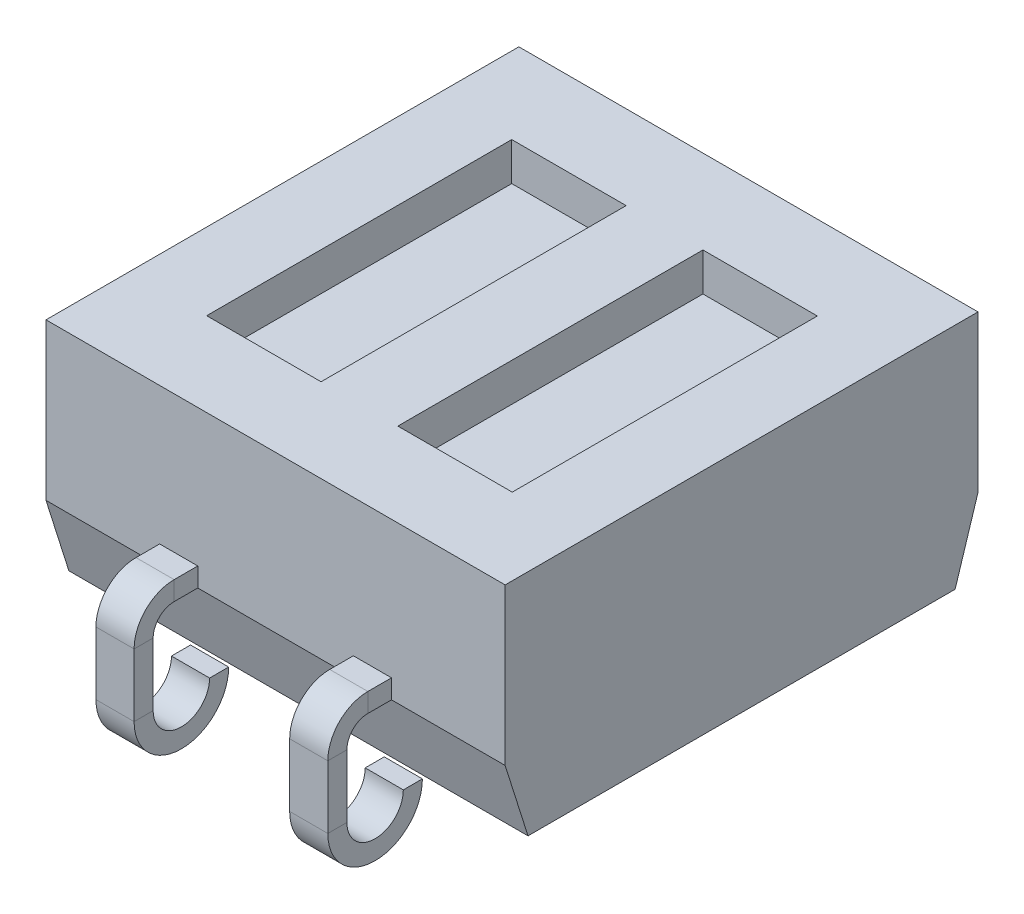
from build123d import *

# Parameters (mm, degrees)
SKETCH_3_W               = 6.02
SKETCH_3_H               = 6.2
EXTRUDE_1_DEPTH          = 3
SKETCH_4_W               = 1.5
SKETCH_4_H               = 4
CUT_EXTRUDE_1_DEPTH      = 0.5
CUT_EXTRUDE_2_DEPTH      = 8.406105589
SKETCH_6_W               = 0.5
SKETCH_6_H               = 0.25
PATTERN_LINEAR_1_COUNT   = 2
PATTERN_LINEAR_1_PITCH   = 2.54
MIRROR_1_COPY_1_SKETCH_W = 0.5
MIRROR_1_COPY_1_SKETCH_H = 0.25


with BuildPart() as part:
    # Эскиз3 → Бобышка-Вытянуть1 (new body)
    with BuildSketch(Plane(origin=(0, 0, 0), x_dir=(1, 0, 0), z_dir=(0, 1, 0))):
        Rectangle(SKETCH_3_W, SKETCH_3_H)
    extrude(amount=EXTRUDE_1_DEPTH)

    # Эскиз4 → Вырез-Вытянуть1 (cut)
    with BuildSketch(Plane(origin=(0, 3, 0), x_dir=(1, 0, 0), z_dir=(0, 1, 0))):
        with Locations((-1.253333333, 0)):
            Rectangle(SKETCH_4_W, SKETCH_4_H)
        with Locations((1.253333333, 0)):
            Rectangle(SKETCH_4_W, SKETCH_4_H)
    extrude(amount=-CUT_EXTRUDE_1_DEPTH, mode=Mode.SUBTRACT)

    # Эскиз5 → Вырез-Вытянуть2 (cut, through all)
    with BuildSketch(Plane(origin=(3.01, 0, 0), x_dir=(0, 0, -1), z_dir=(1, 0, 0))):
        Polygon((-3.1, 0.95), (-2.8, 0), (-3.1, 0), align=None)
        Polygon((3.1, 0), (2.8, 0), (3.1, 0.95), align=None)
    extrude(amount=-CUT_EXTRUDE_2_DEPTH, mode=Mode.SUBTRACT)

    # По траектории1: sweep along a curve in space
    with BuildLine() as sweep_1_path:
        Line((-1.27, 1.075, 3.1), (-1.27, 1.075, 3.41))
        ThreePointArc((-1.27, 1.075, 3.41), (-1.27, 0.957842712, 3.692842712), (-1.27, 0.675, 3.81))
        Line((-1.27, 0.675, 3.81), (-1.27, -0.15, 3.81))
        ThreePointArc((-1.27, -0.15, 3.81), (-1.27, -0.645, 3.315), (-1.27, -0.15, 2.82))
    # Эскиз6 → По траектории1 (sweep)
    with BuildSketch(Plane.XY.offset(3.1)):
        with Locations((-1.27, 1.075)):
            Rectangle(SKETCH_6_W, SKETCH_6_H)
    sweep_1 = sweep(path=sweep_1_path.line)

    # Линейный массив1: По траектории1 ×2
    with Locations(*[(i * PATTERN_LINEAR_1_PITCH, 0, 0) for i in range(1, PATTERN_LINEAR_1_COUNT)]):
        add(sweep_1)

    # Зеркальное отражение1: По траектории1 across plane
    add(sweep_1.mirror(Plane.XY))

    # Зеркальное отражение1 copy 1: sweep along a curve in space
    with BuildLine() as mirror_1_copy_1_path:
        Line((1.27, 1.075, -3.1), (1.27, 1.075, -3.41))
        ThreePointArc((1.27, 1.075, -3.41), (1.27, 0.957842712, -3.692842712), (1.27, 0.675, -3.81))
        Line((1.27, 0.675, -3.81), (1.27, -0.15, -3.81))
        ThreePointArc((1.27, -0.15, -3.81), (1.27, -0.645, -3.315), (1.27, -0.15, -2.82))
    # Зеркальное отражение1 copy 1 sketch → Зеркальное отражение1 copy 1 (sweep)
    with BuildSketch(Plane(origin=(2.54, 0, -3.1), x_dir=(1, 0, 0), z_dir=(0, 0, -1))):
        with Locations((-1.27, -1.075)):
            Rectangle(MIRROR_1_COPY_1_SKETCH_W, MIRROR_1_COPY_1_SKETCH_H)
    sweep(path=mirror_1_copy_1_path.line)


solid = part.part
